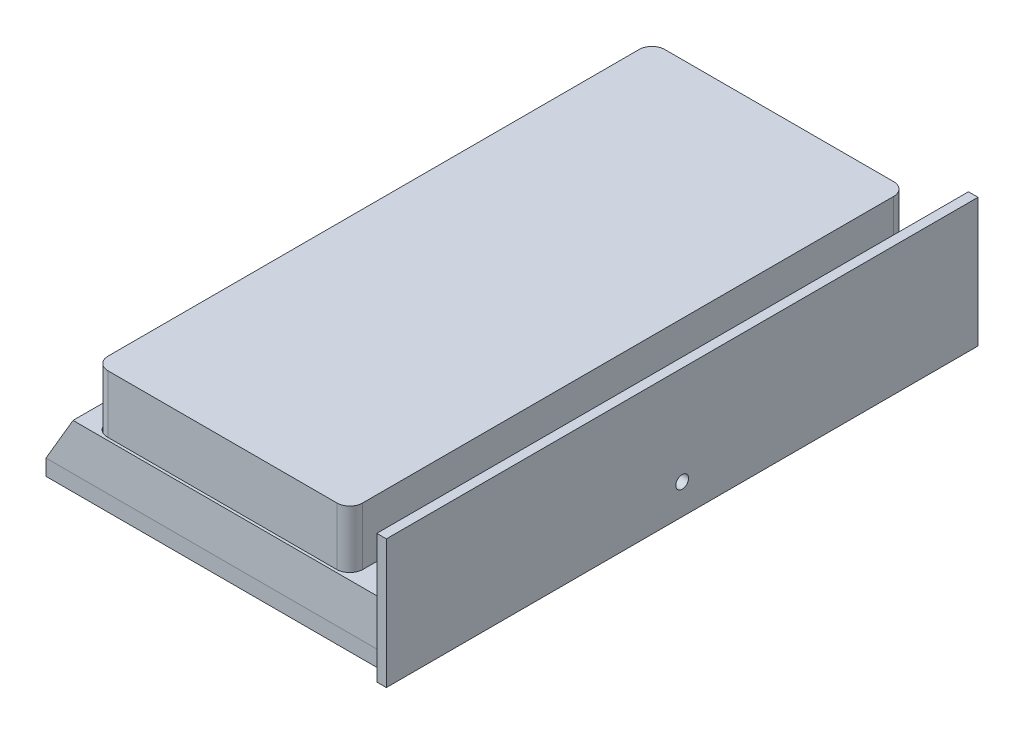
from build123d import *
from OCP.BRepFilletAPI import BRepFilletAPI_MakeChamfer

# Parameters (mm, degrees)
SKETCH1_W           = 80
SKETCH1_H           = 175
BOSS_EXTRUDE1_DEPTH = 33
FILLET1_R           = 4
SKETCH2_W           = 108
SKETCH2_H           = 178
BOSS_EXTRUDE2_DEPTH = 15
SKETCH3_W           = 108
SKETCH3_H           = 178
BOSS_EXTRUDE3_DEPTH = 4
CHAMFER1_SIZE       = 14
CHAMFER1_SIZE2      = 0.5
CHAMFER2_SIZE       = 14
CHAMFER2_SIZE2      = 8
SKETCH8_W           = 186
SKETCH8_H           = 40.5
BOSS_EXTRUDE4_DEPTH = 3
SKETCH9_R           = 2
CUT_EXTRUDE1_DEPTH  = 6
CHAMFER4_SIZE       = 17
CHAMFER4_SIZE2      = 4


with BuildPart() as part:
    # Sketch1 → Boss-Extrude1 (new body)
    with BuildSketch(Plane(origin=(0, 0, 0), x_dir=(1, 0, 0), z_dir=(0, 1, 0))):
        Rectangle(SKETCH1_W, SKETCH1_H)
    extrude(amount=BOSS_EXTRUDE1_DEPTH)

    # Fillet1
    fillet1_edges = [part.edges().sort_by_distance(p)[0] for p in [
        (40, 16.5, 87.5),
        (-40, 16.5, 87.5),
        (-40, 16.5, -87.5),
        (40, 16.5, -87.5),
    ]]
    fillet(fillet1_edges, radius=FILLET1_R)


with BuildPart() as body_2:
    # Sketch2 → Boss-Extrude2 (new body)
    with BuildSketch(Plane(origin=(0, 0, 0), x_dir=(1, 0, 0), z_dir=(0, 1, 0))):
        Rectangle(SKETCH2_W, SKETCH2_H)
        with BuildLine():
            Line((36, 87.65), (-36, 87.65))
            ThreePointArc((-36, 87.65), (-38.934493142, 86.434493142), (-40.15, 83.5))
            Line((-40.15, 83.5), (-40.15, -83.5))
            ThreePointArc((-40.15, -83.5), (-38.934493142, -86.434493142), (-36, -87.65))
            Line((-36, -87.65), (36, -87.65))
            ThreePointArc((36, -87.65), (38.934493142, -86.434493142), (40.15, -83.5))
            Line((40.15, -83.5), (40.15, 83.5))
            ThreePointArc((40.15, 83.5), (38.934493142, 86.434493142), (36, 87.65))
        make_face(mode=Mode.SUBTRACT)
    extrude(amount=BOSS_EXTRUDE2_DEPTH)

    # Sketch3 → Boss-Extrude3 (add)
    with BuildSketch(Plane.XZ):
        Rectangle(SKETCH3_W, SKETCH3_H)
    extrude(amount=BOSS_EXTRUDE3_DEPTH)

    # Chamfer1: one chamfer whose edges measure the first distance from different faces: ONE call of the kernel's chamfer builder (chamfer() names one face for all edges)
    chamfer1_edges_1 = [body_2.edges().sort_by_distance(p)[0] for p in [
        (0, 15, 89),
    ]]
    chamfer1_side_1 = [body_2.faces().sort_by_distance(p)[0] for p in [
        (0, 5.5, 89),
    ]]
    chamfer1_edges_2 = [body_2.edges().sort_by_distance(p)[0] for p in [
        (0, 15, -89),
    ]]
    chamfer1_side_2 = [body_2.faces().sort_by_distance(p)[0] for p in [
        (0, 5.5, -89),
    ]]
    chamfer1 = BRepFilletAPI_MakeChamfer(body_2.part.solid().wrapped)
    for e in chamfer1_edges_1:
        chamfer1.Add(CHAMFER1_SIZE, CHAMFER1_SIZE2, e.wrapped, chamfer1_side_1[0].wrapped)  # the first distance lies on this face
    for e in chamfer1_edges_2:
        chamfer1.Add(CHAMFER1_SIZE, CHAMFER1_SIZE2, e.wrapped, chamfer1_side_2[0].wrapped)  # the first distance lies on this face
    add(Compound.cast(chamfer1.Shape()), mode=Mode.REPLACE)

    # Chamfer2
    chamfer2_edges = [body_2.edges().sort_by_distance(p)[0] for p in [
        (-54, 15, 0),
    ]]
    chamfer2_side = [body_2.faces().sort_by_distance(p)[0] for p in [
        (-54, 5.489975309, 0),
    ]]
    chamfer(chamfer2_edges, length=CHAMFER2_SIZE, length2=CHAMFER2_SIZE2, reference=chamfer2_side[0])

    # Sketch8 → Boss-Extrude4 (add)
    with BuildSketch(Plane(origin=(54, 0, 0), x_dir=(0, 0, -1), z_dir=(1, 0, 0))):
        with Locations((0, 16.25)):
            Rectangle(SKETCH8_W, SKETCH8_H)
    extrude(amount=BOSS_EXTRUDE4_DEPTH)

    # Sketch9 → Cut-Extrude1 (cut)
    with BuildSketch(Plane(origin=(57, 0, 0), x_dir=(0, 0, -1), z_dir=(1, 0, 0))):
        with Locations((0, 5.5)):
            Circle(SKETCH9_R)
    extrude(amount=-CUT_EXTRUDE1_DEPTH, mode=Mode.SUBTRACT)

    # Chamfer4
    chamfer4_edges = [body_2.edges().sort_by_distance(p)[0] for p in [
        (54, 15, 0),
    ]]
    chamfer4_side = [body_2.faces().sort_by_distance(p)[0] for p in [
        (54, 24.983786275, 0),
    ]]
    chamfer(chamfer4_edges, length=CHAMFER4_SIZE, length2=CHAMFER4_SIZE2, reference=chamfer4_side[0])


solid = Compound([part.part, body_2.part])
